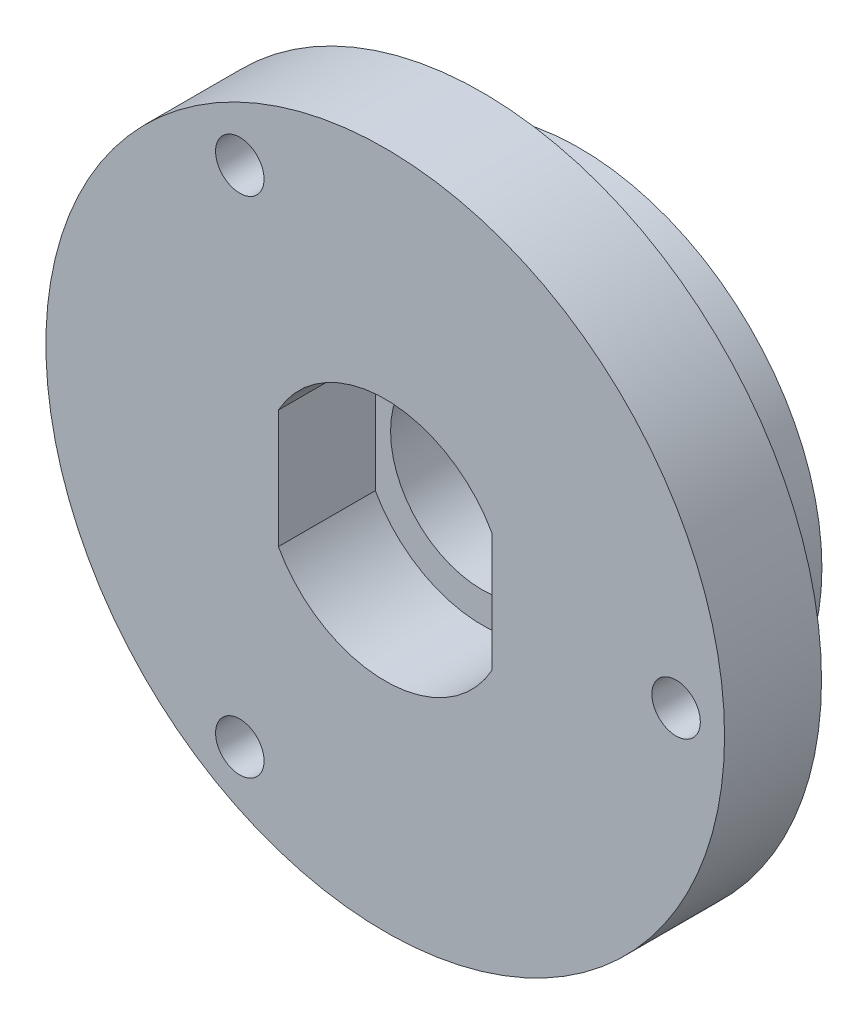
from build123d import *

# Parameters (mm, degrees)
SKETCH1_R           = 7.9375
BOSS_EXTRUDE1_DEPTH = 3.188
SKETCH2_R           = 11.1125
BOSS_EXTRUDE2_DEPTH = 3.17500635
CUT_EXTRUDE2_DEPTH  = 3.17500635
CUT_EXTRUDE3_REACH  = 18.955
SKETCH4_R           = 3
CUT_EXTRUDE5_REACH  = 18.955
SKETCH5_R           = 0.79375


with BuildPart() as part:
    # Sketch1 → Boss-Extrude1 (new body)
    with BuildSketch(Plane.XY):
        Circle(SKETCH1_R)
    extrude(amount=BOSS_EXTRUDE1_DEPTH)

    # Sketch2 → Boss-Extrude2 (add)
    with BuildSketch(Plane.XY.offset(3.188)):
        Circle(SKETCH2_R)
    extrude(amount=BOSS_EXTRUDE2_DEPTH)

    # Sketch3 → Cut-Extrude2 (cut)
    with BuildSketch(Plane.XY.offset(6.36300635)):
        with BuildLine():
            Line((3.499995393, -1.9365), (3.499995393, 1.9365))
            ThreePointArc((3.499995393, 1.9365), (0, 4), (-3.499995393, 1.9365))
            Line((-3.499995393, 1.9365), (-3.499995393, -1.9365))
            ThreePointArc((-3.499995393, -1.9365), (0, -4), (3.499995393, -1.9365))
        make_face()
    extrude(amount=-CUT_EXTRUDE2_DEPTH, mode=Mode.SUBTRACT)

    # Sketch4 → Cut-Extrude3 (cut, up to next)
    with BuildSketch(Plane(origin=(0, 0, 0), x_dir=(-1, 0, 0), z_dir=(0, 0, -1)), mode=Mode.PRIVATE) as cut_extrude3_sk1:
        Circle(SKETCH4_R)
    cut_extrude3_tool1 = extrude(cut_extrude3_sk1.sketch, amount=-CUT_EXTRUDE3_REACH, mode=Mode.PRIVATE) & part.part
    add(cut_extrude3_tool1.solids().sort_by_distance((0, 0, 0))[0], mode=Mode.SUBTRACT)

    # Sketch5 → Cut-Extrude5 (cut, up to next)
    with BuildSketch(Plane.XY.offset(6.36300635), mode=Mode.PRIVATE) as cut_extrude5_sk1:
        with Locations((-4.7625, 8.248891971)):
            Circle(SKETCH5_R)
    cut_extrude5_tool1 = extrude(cut_extrude5_sk1.sketch, amount=-CUT_EXTRUDE5_REACH, mode=Mode.PRIVATE) & part.part
    # Sketch5 → Cut-Extrude5 (cut, up to next)
    with BuildSketch(Plane.XY.offset(6.36300635), mode=Mode.PRIVATE) as cut_extrude5_sk2:
        with Locations((-4.7625, -8.248891971)):
            Circle(SKETCH5_R)
    cut_extrude5_tool2 = extrude(cut_extrude5_sk2.sketch, amount=-CUT_EXTRUDE5_REACH, mode=Mode.PRIVATE) & part.part
    # Sketch5 → Cut-Extrude5 (cut, up to next)
    with BuildSketch(Plane.XY.offset(6.36300635), mode=Mode.PRIVATE) as cut_extrude5_sk3:
        with Locations((9.525, 0)):
            Circle(SKETCH5_R)
    cut_extrude5_tool3 = extrude(cut_extrude5_sk3.sketch, amount=-CUT_EXTRUDE5_REACH, mode=Mode.PRIVATE) & part.part
    add(cut_extrude5_tool1.solids().sort_by_distance((-4.7625, 8.248892, 6.363006))[0], mode=Mode.SUBTRACT)
    add(cut_extrude5_tool2.solids().sort_by_distance((-4.7625, -8.248892, 6.363006))[0], mode=Mode.SUBTRACT)
    add(cut_extrude5_tool3.solids().sort_by_distance((9.525, 0, 6.363006))[0], mode=Mode.SUBTRACT)


solid = part.part
